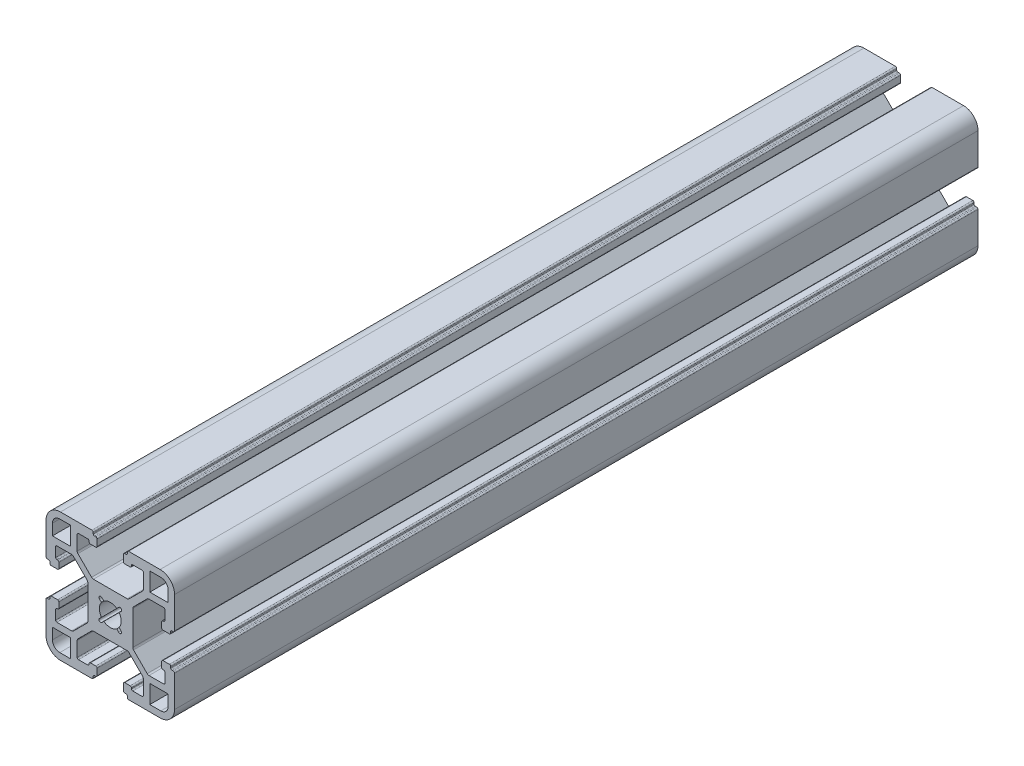
from build123d import *

# Parameters (mm, degrees)
BOSS_EXTRUDE1_DEPTH = 250


with BuildPart() as part:
    # Sketch1 → Boss-Extrude1 (new body)
    with BuildSketch(Plane.XY.offset(25)):
        with BuildLine():
            Line((-15.5, -20), (-5.7, -20))
            ThreePointArc((-5.7, -20), (-5.417157288, -19.882842712), (-5.3, -19.6))
            Line((-5.3, -19.6), (-5.3, -19.2))
            ThreePointArc((-5.3, -19.2), (-5.182842712, -18.917157288), (-4.9, -18.8))
            Line((-4.9, -18.8), (-4.5, -18.8))
            ThreePointArc((-4.5, -18.8), (-4.217157288, -18.682842712), (-4.1, -18.4))
            Line((-4.1, -18.4), (-4.1, -16.4))
            ThreePointArc((-4.1, -16.4), (-4.217157288, -16.117157288), (-4.5, -16))
            Line((-4.5, -16), (-6.18, -16))
            ThreePointArc((-6.18, -16), (-6.462842712, -16.117157288), (-6.58, -16.4))
            Line((-6.58, -16.4), (-6.58, -16.6))
            ThreePointArc((-6.58, -16.6), (-6.697157288, -16.882842712), (-6.98, -17))
            Line((-6.98, -17), (-9.9, -17))
            ThreePointArc((-9.9, -17), (-10.182842712, -16.882842712), (-10.3, -16.6))
            Line((-10.3, -16.6), (-10.3, -12.045584412))
            ThreePointArc((-10.3, -12.045584412), (-10.239103626, -11.739437666), (-10.065685425, -11.479898987))
            Line((-10.065685425, -11.479898987), (-5.820101013, -7.234314575))
            ThreePointArc((-5.820101013, -7.234314575), (-5.560562334, -7.060896374), (-5.254415588, -7))
            Line((-5.254415588, -7), (5.254415588, -7))
            ThreePointArc((5.254415588, -7), (5.560562334, -7.060896374), (5.820101013, -7.234314575))
            Line((5.820101013, -7.234314575), (10.065685425, -11.479898987))
            ThreePointArc((10.065685425, -11.479898987), (10.239103626, -11.739437666), (10.3, -12.045584412))
            Line((10.3, -12.045584412), (10.3, -16.6))
            ThreePointArc((10.3, -16.6), (10.182842712, -16.882842712), (9.9, -17))
            Line((9.9, -17), (6.98, -17))
            ThreePointArc((6.98, -17), (6.697157288, -16.882842712), (6.58, -16.6))
            Line((6.58, -16.6), (6.58, -16.4))
            ThreePointArc((6.58, -16.4), (6.462842712, -16.117157288), (6.18, -16))
            Line((6.18, -16), (4.5, -16))
            ThreePointArc((4.5, -16), (4.217157288, -16.117157288), (4.1, -16.4))
            Line((4.1, -16.4), (4.1, -18.4))
            ThreePointArc((4.1, -18.4), (4.217157288, -18.682842712), (4.5, -18.8))
            Line((4.5, -18.8), (4.9, -18.8))
            ThreePointArc((4.9, -18.8), (5.182842712, -18.917157288), (5.3, -19.2))
            Line((5.3, -19.2), (5.3, -19.6))
            ThreePointArc((5.3, -19.6), (5.417157288, -19.882842712), (5.7, -20))
            Line((5.7, -20), (15.5, -20))
            ThreePointArc((15.5, -20), (18.681980515, -18.681980515), (20, -15.5))
            Line((20, -15.5), (20, -5.7))
            ThreePointArc((20, -5.7), (19.882842712, -5.417157288), (19.6, -5.3))
            Line((19.6, -5.3), (19.2, -5.3))
            ThreePointArc((19.2, -5.3), (18.917157288, -5.182842712), (18.8, -4.9))
            Line((18.8, -4.9), (18.8, -4.5))
            ThreePointArc((18.8, -4.5), (18.682842712, -4.217157288), (18.4, -4.1))
            Line((18.4, -4.1), (16.4, -4.1))
            ThreePointArc((16.4, -4.1), (16.117157288, -4.217157288), (16, -4.5))
            Line((16, -4.5), (16, -6.18))
            ThreePointArc((16, -6.18), (16.117157288, -6.462842712), (16.4, -6.58))
            Line((16.4, -6.58), (16.6, -6.58))
            ThreePointArc((16.6, -6.58), (16.882842712, -6.697157288), (17, -6.98))
            Line((17, -6.98), (17, -9.9))
            ThreePointArc((17, -9.9), (16.882842712, -10.182842712), (16.6, -10.3))
            Line((16.6, -10.3), (12.045584412, -10.3))
            ThreePointArc((12.045584412, -10.3), (11.739437666, -10.239103626), (11.479898987, -10.065685425))
            Line((11.479898987, -10.065685425), (7.234314575, -5.820101013))
            ThreePointArc((7.234314575, -5.820101013), (7.060896374, -5.560562334), (7, -5.254415588))
            Line((7, -5.254415588), (7, 5.254415588))
            ThreePointArc((7, 5.254415588), (7.060896374, 5.560562334), (7.234314575, 5.820101013))
            Line((7.234314575, 5.820101013), (11.479898987, 10.065685425))
            ThreePointArc((11.479898987, 10.065685425), (11.739437666, 10.239103626), (12.045584412, 10.3))
            Line((12.045584412, 10.3), (16.6, 10.3))
            ThreePointArc((16.6, 10.3), (16.882842712, 10.182842712), (17, 9.9))
            Line((17, 9.9), (17, 6.98))
            ThreePointArc((17, 6.98), (16.882842712, 6.697157288), (16.6, 6.58))
            Line((16.6, 6.58), (16.4, 6.58))
            ThreePointArc((16.4, 6.58), (16.117157288, 6.462842712), (16, 6.18))
            Line((16, 6.18), (16, 4.5))
            ThreePointArc((16, 4.5), (16.117157288, 4.217157288), (16.4, 4.1))
            Line((16.4, 4.1), (18.4, 4.1))
            ThreePointArc((18.4, 4.1), (18.682842712, 4.217157288), (18.8, 4.5))
            Line((18.8, 4.5), (18.8, 4.9))
            ThreePointArc((18.8, 4.9), (18.917157288, 5.182842712), (19.2, 5.3))
            Line((19.2, 5.3), (19.6, 5.3))
            ThreePointArc((19.6, 5.3), (19.882842712, 5.417157288), (20, 5.7))
            Line((20, 5.7), (20, 15.5))
            ThreePointArc((20, 15.5), (18.681980515, 18.681980515), (15.5, 20))
            Line((15.5, 20), (5.7, 20))
            ThreePointArc((5.7, 20), (5.417157288, 19.882842712), (5.3, 19.6))
            Line((5.3, 19.6), (5.3, 19.2))
            ThreePointArc((5.3, 19.2), (5.182842712, 18.917157288), (4.9, 18.8))
            Line((4.9, 18.8), (4.5, 18.8))
            ThreePointArc((4.5, 18.8), (4.217157288, 18.682842712), (4.1, 18.4))
            Line((4.1, 18.4), (4.1, 16.4))
            ThreePointArc((4.1, 16.4), (4.217157288, 16.117157288), (4.5, 16))
            Line((4.5, 16), (6.18, 16))
            ThreePointArc((6.18, 16), (6.462842712, 16.117157288), (6.58, 16.4))
            Line((6.58, 16.4), (6.58, 16.6))
            ThreePointArc((6.58, 16.6), (6.697157288, 16.882842712), (6.98, 17))
            Line((6.98, 17), (9.9, 17))
            ThreePointArc((9.9, 17), (10.182842712, 16.882842712), (10.3, 16.6))
            Line((10.3, 16.6), (10.3, 12.045584412))
            ThreePointArc((10.3, 12.045584412), (10.239103626, 11.739437666), (10.065685425, 11.479898987))
            Line((10.065685425, 11.479898987), (5.820101013, 7.234314575))
            ThreePointArc((5.820101013, 7.234314575), (5.560562334, 7.060896374), (5.254415588, 7))
            Line((5.254415588, 7), (-5.254415588, 7))
            ThreePointArc((-5.254415588, 7), (-5.560562334, 7.060896374), (-5.820101013, 7.234314575))
            Line((-5.820101013, 7.234314575), (-10.065685425, 11.479898987))
            ThreePointArc((-10.065685425, 11.479898987), (-10.239103626, 11.739437666), (-10.3, 12.045584412))
            Line((-10.3, 12.045584412), (-10.3, 16.6))
            ThreePointArc((-10.3, 16.6), (-10.182842712, 16.882842712), (-9.9, 17))
            Line((-9.9, 17), (-6.98, 17))
            ThreePointArc((-6.98, 17), (-6.697157288, 16.882842712), (-6.58, 16.6))
            Line((-6.58, 16.6), (-6.58, 16.4))
            ThreePointArc((-6.58, 16.4), (-6.462842712, 16.117157288), (-6.18, 16))
            Line((-6.18, 16), (-4.5, 16))
            ThreePointArc((-4.5, 16), (-4.217157288, 16.117157288), (-4.1, 16.4))
            Line((-4.1, 16.4), (-4.1, 18.4))
            ThreePointArc((-4.1, 18.4), (-4.217157288, 18.682842712), (-4.5, 18.8))
            Line((-4.5, 18.8), (-4.9, 18.8))
            ThreePointArc((-4.9, 18.8), (-5.182842712, 18.917157288), (-5.3, 19.2))
            Line((-5.3, 19.2), (-5.3, 19.6))
            ThreePointArc((-5.3, 19.6), (-5.417157288, 19.882842712), (-5.7, 20))
            Line((-5.7, 20), (-15.5, 20))
            ThreePointArc((-15.5, 20), (-18.681980515, 18.681980515), (-20, 15.5))
            Line((-20, 15.5), (-20, 5.7))
            ThreePointArc((-20, 5.7), (-19.882842712, 5.417157288), (-19.6, 5.3))
            Line((-19.6, 5.3), (-19.2, 5.3))
            ThreePointArc((-19.2, 5.3), (-18.917157288, 5.182842712), (-18.8, 4.9))
            Line((-18.8, 4.9), (-18.8, 4.5))
            ThreePointArc((-18.8, 4.5), (-18.682842712, 4.217157288), (-18.4, 4.1))
            Line((-18.4, 4.1), (-16.4, 4.1))
            ThreePointArc((-16.4, 4.1), (-16.117157288, 4.217157288), (-16, 4.5))
            Line((-16, 4.5), (-16, 6.18))
            ThreePointArc((-16, 6.18), (-16.117157288, 6.462842712), (-16.4, 6.58))
            Line((-16.4, 6.58), (-16.6, 6.58))
            ThreePointArc((-16.6, 6.58), (-16.882842712, 6.697157288), (-17, 6.98))
            Line((-17, 6.98), (-17, 9.9))
            ThreePointArc((-17, 9.9), (-16.882842712, 10.182842712), (-16.6, 10.3))
            Line((-16.6, 10.3), (-12.045584412, 10.3))
            ThreePointArc((-12.045584412, 10.3), (-11.739437666, 10.239103626), (-11.479898987, 10.065685425))
            Line((-11.479898987, 10.065685425), (-7.234314575, 5.820101013))
            ThreePointArc((-7.234314575, 5.820101013), (-7.060896374, 5.560562334), (-7, 5.254415588))
            Line((-7, 5.254415588), (-7, -5.254415588))
            ThreePointArc((-7, -5.254415588), (-7.060896374, -5.560562334), (-7.234314575, -5.820101013))
            Line((-7.234314575, -5.820101013), (-11.479898987, -10.065685425))
            ThreePointArc((-11.479898987, -10.065685425), (-11.739437666, -10.239103626), (-12.045584412, -10.3))
            Line((-12.045584412, -10.3), (-16.6, -10.3))
            ThreePointArc((-16.6, -10.3), (-16.882842712, -10.182842712), (-17, -9.9))
            Line((-17, -9.9), (-17, -6.98))
            ThreePointArc((-17, -6.98), (-16.882842712, -6.697157288), (-16.6, -6.58))
            Line((-16.6, -6.58), (-16.4, -6.58))
            ThreePointArc((-16.4, -6.58), (-16.117157288, -6.462842712), (-16, -6.18))
            Line((-16, -6.18), (-16, -4.5))
            ThreePointArc((-16, -4.5), (-16.117157288, -4.217157288), (-16.4, -4.1))
            Line((-16.4, -4.1), (-18.4, -4.1))
            ThreePointArc((-18.4, -4.1), (-18.682842712, -4.217157288), (-18.8, -4.5))
            Line((-18.8, -4.5), (-18.8, -4.9))
            ThreePointArc((-18.8, -4.9), (-18.917157288, -5.182842712), (-19.2, -5.3))
            Line((-19.2, -5.3), (-19.6, -5.3))
            ThreePointArc((-19.6, -5.3), (-19.882842712, -5.417157288), (-20, -5.7))
            Line((-20, -5.7), (-20, -15.5))
            ThreePointArc((-20, -15.5), (-18.681980515, -18.681980515), (-15.5, -20))
        make_face()
        with BuildLine():
            Line((18, 15.72), (18, 12.3))
            Line((18, 12.3), (12.3, 12.3))
            Line((12.3, 12.3), (12.3, 18))
            Line((12.3, 18), (15.72, 18))
            ThreePointArc((15.72, 18), (17.332203461, 17.332203461), (18, 15.72))
        make_face(mode=Mode.SUBTRACT)
        with BuildLine():
            Line((-18, -15.72), (-18, -12.3))
            Line((-18, -12.3), (-12.3, -12.3))
            Line((-12.3, -12.3), (-12.3, -18))
            Line((-12.3, -18), (-15.72, -18))
            ThreePointArc((-15.72, -18), (-17.332203461, -17.332203461), (-18, -15.72))
        make_face(mode=Mode.SUBTRACT)
        with BuildLine():
            Line((2.010111251, 2.742162059), (2.633777471, 3.365828278))
            ThreePointArc((2.633777471, 3.365828278), (3.365828278, 3.365828278), (3.365828278, 2.633777471))
            Line((3.365828278, 2.633777471), (2.742162059, 2.010111251))
            ThreePointArc((2.742162059, 2.010111251), (3.4, 0), (2.742162059, -2.010111251))
            Line((2.742162059, -2.010111251), (3.365828278, -2.633777471))
            ThreePointArc((3.365828278, -2.633777471), (3.365828278, -3.365828278), (2.633777471, -3.365828278))
            Line((2.633777471, -3.365828278), (2.010111251, -2.742162059))
            ThreePointArc((2.010111251, -2.742162059), (0, -3.4), (-2.010111251, -2.742162059))
            Line((-2.010111251, -2.742162059), (-2.633777471, -3.365828278))
            ThreePointArc((-2.633777471, -3.365828278), (-3.365828278, -3.365828278), (-3.365828278, -2.633777471))
            Line((-3.365828278, -2.633777471), (-2.742162059, -2.010111251))
            ThreePointArc((-2.742162059, -2.010111251), (-3.4, 0), (-2.742162059, 2.010111251))
            Line((-2.742162059, 2.010111251), (-3.365828278, 2.633777471))
            ThreePointArc((-3.365828278, 2.633777471), (-3.365828278, 3.365828278), (-2.633777471, 3.365828278))
            Line((-2.633777471, 3.365828278), (-2.010111251, 2.742162059))
            ThreePointArc((-2.010111251, 2.742162059), (0, 3.4), (2.010111251, 2.742162059))
        make_face(mode=Mode.SUBTRACT)
        with BuildLine():
            Line((15.72, -18), (12.3, -18))
            Line((12.3, -18), (12.3, -12.3))
            Line((12.3, -12.3), (18, -12.3))
            Line((18, -12.3), (18, -15.72))
            ThreePointArc((18, -15.72), (17.332203461, -17.332203461), (15.72, -18))
        make_face(mode=Mode.SUBTRACT)
        with BuildLine():
            Line((-15.72, 18), (-12.3, 18))
            Line((-12.3, 18), (-12.3, 12.3))
            Line((-12.3, 12.3), (-18, 12.3))
            Line((-18, 12.3), (-18, 15.72))
            ThreePointArc((-18, 15.72), (-17.332203461, 17.332203461), (-15.72, 18))
        make_face(mode=Mode.SUBTRACT)
    extrude(amount=-BOSS_EXTRUDE1_DEPTH)


solid = part.part
